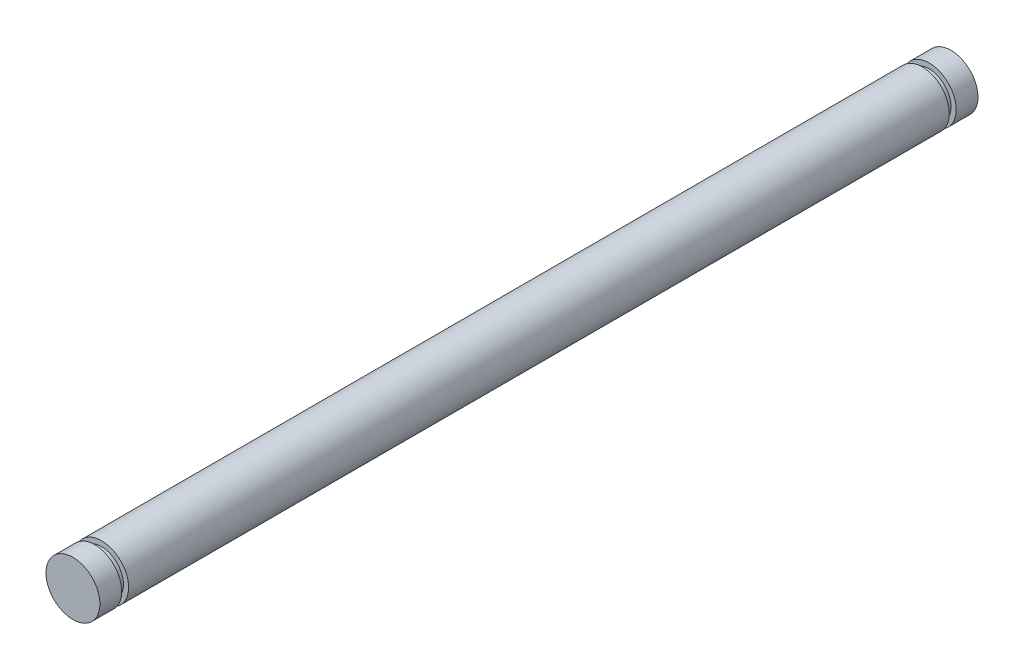
from build123d import *

# Parameters (mm, degrees)
SKETCH1_R           = 2
BOSS_EXTRUDE1_DEPTH = 32.54375
SKETCH2_W           = 0.508
SKETCH2_H           = 0.381


with BuildPart() as part:
    # Sketch1 → Boss-Extrude1 (new, symmetric)
    with BuildSketch(Plane.XY):
        Circle(SKETCH1_R)
    extrude(amount=BOSS_EXTRUDE1_DEPTH, both=True)

    # Sketch2 → Cut-Revolve1 (revolve, cut)
    with BuildSketch(Plane(origin=(0, 0, 0), x_dir=(0, 0, -1), z_dir=(1, 0, 0)), mode=Mode.PRIVATE) as cut_revolve1_sk:
        with Locations((-30.6705, 1.8095)):
            Rectangle(SKETCH2_W, SKETCH2_H)
    cut_revolve1 = revolve(cut_revolve1_sk.sketch.rotate(Axis((0, 0, 32.54375), (0, 0, -1)), 90), axis=Axis((0, 0, 32.54375), (0, 0, -1)), mode=Mode.SUBTRACT)

    # Mirror1: Cut-Revolve1 across plane
    add(cut_revolve1.mirror(Plane.XY), mode=Mode.SUBTRACT)


solid = part.part
